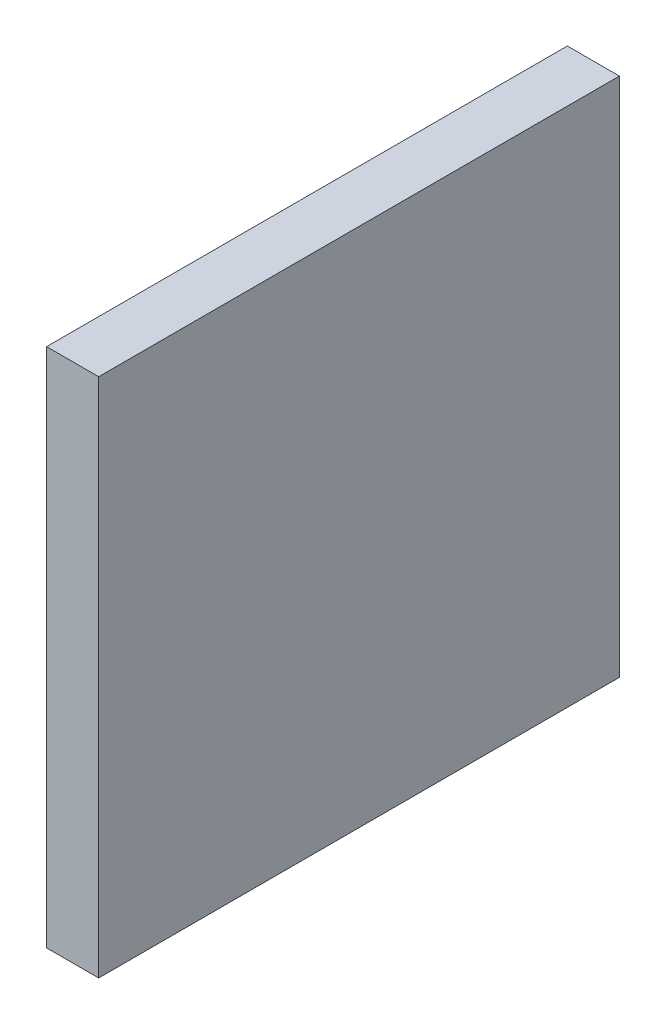
from build123d import *

# Parameters (mm, degrees)
SKETCH_1_W      = 100
SKETCH_1_H      = 100
EXTRUDE_1_DEPTH = 10


with BuildPart() as part:
    # 草图1 → 凸台-拉伸1 (new body)
    with BuildSketch(Plane(origin=(0, 0, 0), x_dir=(0, 0, -1), z_dir=(1, 0, 0))):
        with Locations((50, 50)):
            Rectangle(SKETCH_1_W, SKETCH_1_H)
    extrude(amount=EXTRUDE_1_DEPTH)


solid = part.part
